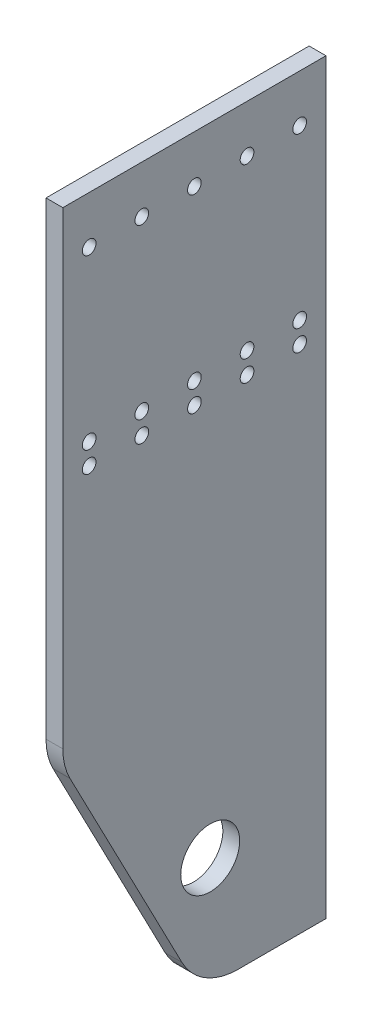
from build123d import *

# Parameters (mm, degrees)
SKETCH_1_W             = 250
SKETCH_1_H             = 750
EXTRUDE_1_DEPTH        = 16
CUT_EXTRUDE_2_DEPTH    = 20
SKETCH_5_R             = 6.5
CUT_EXTRUDE_3_DEPTH    = 791.731307082
PATTERN_LINEAR_1_COUNT = 5
PATTERN_LINEAR_1_PITCH = 50
SKETCH_6_R             = 28
CUT_EXTRUDE_4_DEPTH    = 791.731307082
FILLET_1_R             = 60
SKETCH_7_W             = 250
SKETCH_7_H             = 40
CUT_EXTRUDE_5_DEPTH    = 66


with BuildPart() as part:
    # 草图1 → 凸台-拉伸1 (new body)
    with BuildSketch(Plane(origin=(0, 0, 0), x_dir=(0, 0, -1), z_dir=(1, 0, 0))):
        with Locations((125, 375)):
            Rectangle(SKETCH_1_W, SKETCH_1_H)
    extrude(amount=EXTRUDE_1_DEPTH)

    # 草图3 → 切除-拉伸2 (cut)
    with BuildSketch(Plane.ZY):
        Polygon((-130, 0), (0, 250), (0, 0), align=None)
    extrude(amount=-CUT_EXTRUDE_2_DEPTH, mode=Mode.SUBTRACT)

    # 草图5 → 切除-拉伸3 (cut, through all)
    with BuildSketch(Plane.ZY):
        with Locations((-225, 665)):
            Circle(SKETCH_5_R)
        with Locations((-225, 505)):
            Circle(SKETCH_5_R)
        with Locations((-225, 485)):
            Circle(SKETCH_5_R)
    cut_extrude_3 = extrude(amount=-CUT_EXTRUDE_3_DEPTH, mode=Mode.SUBTRACT)

    # 阵列(线性)1: 切除-拉伸3 ×5
    with Locations(*[(0, 0, i * PATTERN_LINEAR_1_PITCH) for i in range(1, PATTERN_LINEAR_1_COUNT)]):
        add(cut_extrude_3, mode=Mode.SUBTRACT)

    # 草图6 → 切除-拉伸4 (cut, through all)
    with BuildSketch(Plane.ZY):
        with Locations((-140, 105)):
            Circle(SKETCH_6_R)
    extrude(amount=-CUT_EXTRUDE_4_DEPTH, mode=Mode.SUBTRACT)

    # 圆角1
    fillet_1_edges = [part.edges().sort_by_distance(p)[0] for p in [
        (8, 0, -130),
        (8, 250, 0),
    ]]
    fillet(fillet_1_edges, radius=FILLET_1_R)

    # 草图7 → 切除-拉伸5 (cut)
    with BuildSketch(Plane(origin=(16, 0, 0), x_dir=(0, 0, -1), z_dir=(1, 0, 0))):
        with Locations((125, 730)):
            Rectangle(SKETCH_7_W, SKETCH_7_H)
    extrude(amount=-CUT_EXTRUDE_5_DEPTH, mode=Mode.SUBTRACT)


solid = part.part
